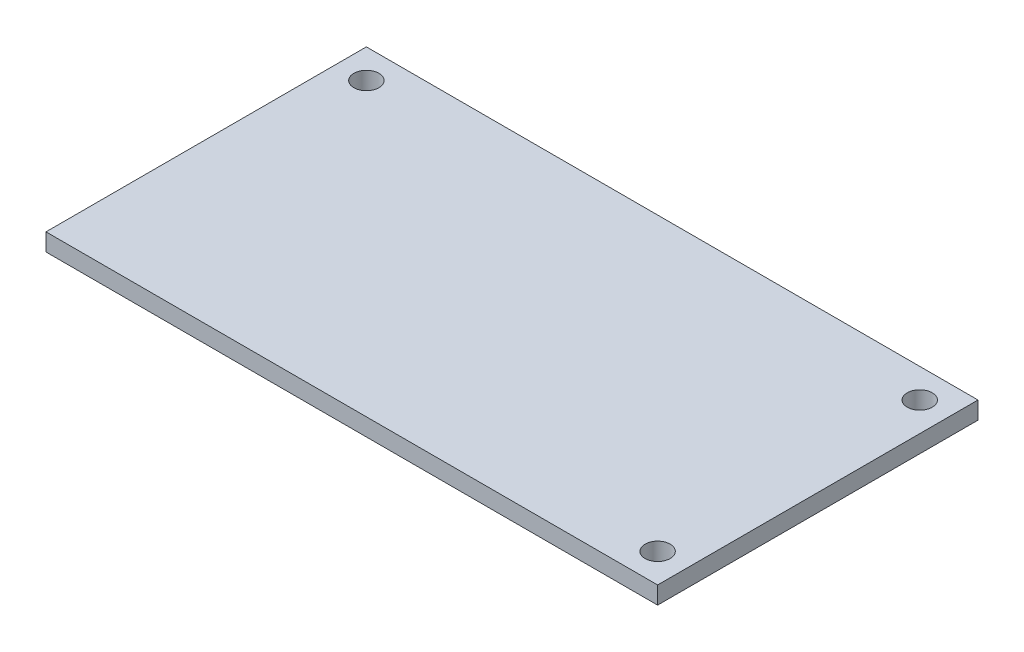
from build123d import *

# Parameters (mm, degrees)
SKETCH1_W           = 53.34
SKETCH1_H           = 27.94
BOSS_EXTRUDE1_DEPTH = 1.524
SKETCH2_R           = 1.0922
CUT_EXTRUDE1_DEPTH  = 1.524


with BuildPart() as part:
    # Sketch1 → Boss-Extrude1 (new body)
    with BuildSketch(Plane(origin=(0, 0, 0), x_dir=(1, 0, 0), z_dir=(0, 1, 0))):
        with Locations((26.67, 13.97)):
            Rectangle(SKETCH1_W, SKETCH1_H)
    extrude(amount=BOSS_EXTRUDE1_DEPTH)

    # Sketch2 → Cut-Extrude1 (cut)
    with BuildSketch(Plane(origin=(0, 1.524, 0), x_dir=(1, 0, 0), z_dir=(0, 1, 0))):
        with Locations(Location((2.54, 25.4, 0), (0, 0, 270))):
            Circle(SKETCH2_R)
        with Locations(Location((50.8, 25.4, 0), (0, 0, 270))):
            Circle(SKETCH2_R)
        with Locations(Location((50.8, 2.54, 0), (0, 0, 270))):
            Circle(SKETCH2_R)
    extrude(amount=-CUT_EXTRUDE1_DEPTH, mode=Mode.SUBTRACT)


solid = part.part
